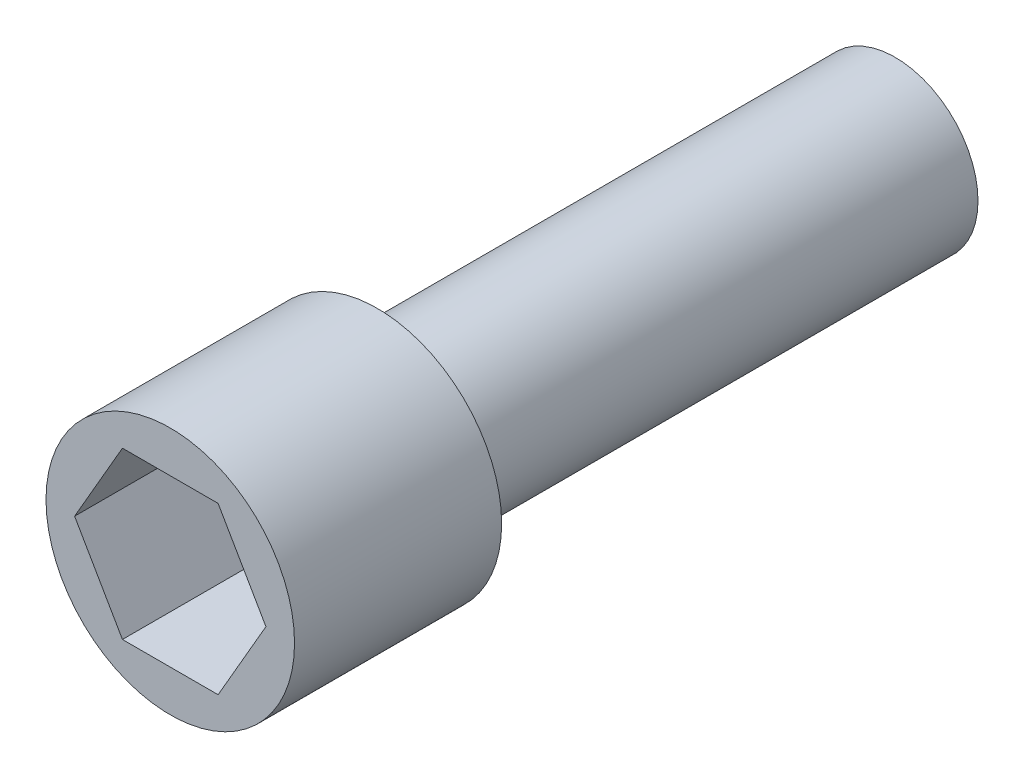
from build123d import *

# Parameters (mm, degrees)
SKETCH1_R           = 6
BOSS_EXTRUDE1_DEPTH = 10
SKETCH1_3_R         = 4
BOSS_EXTRUDE2_DEPTH = 35
CUT_EXTRUDE1_DEPTH  = 7


with BuildPart() as part:
    # Sketch1 → Boss-Extrude1 (new body)
    with BuildSketch(Plane.XY):
        Circle(SKETCH1_R)
    extrude(amount=-BOSS_EXTRUDE1_DEPTH)

    # Sketch1<3> → Boss-Extrude2 (add)
    with BuildSketch(Plane.XY):
        Circle(SKETCH1_3_R)
    extrude(amount=-BOSS_EXTRUDE2_DEPTH)

    # Sketch1<4> → Cut-Extrude1 (cut)
    with BuildSketch(Plane.XY):
        Polygon((4.618802154, 0), (2.309401077, 4), (-2.309401077, 4), (-4.618802154, 0), (-2.309401077, -4), (2.309401077, -4), align=None)
    extrude(amount=-CUT_EXTRUDE1_DEPTH, mode=Mode.SUBTRACT)


solid = part.part
